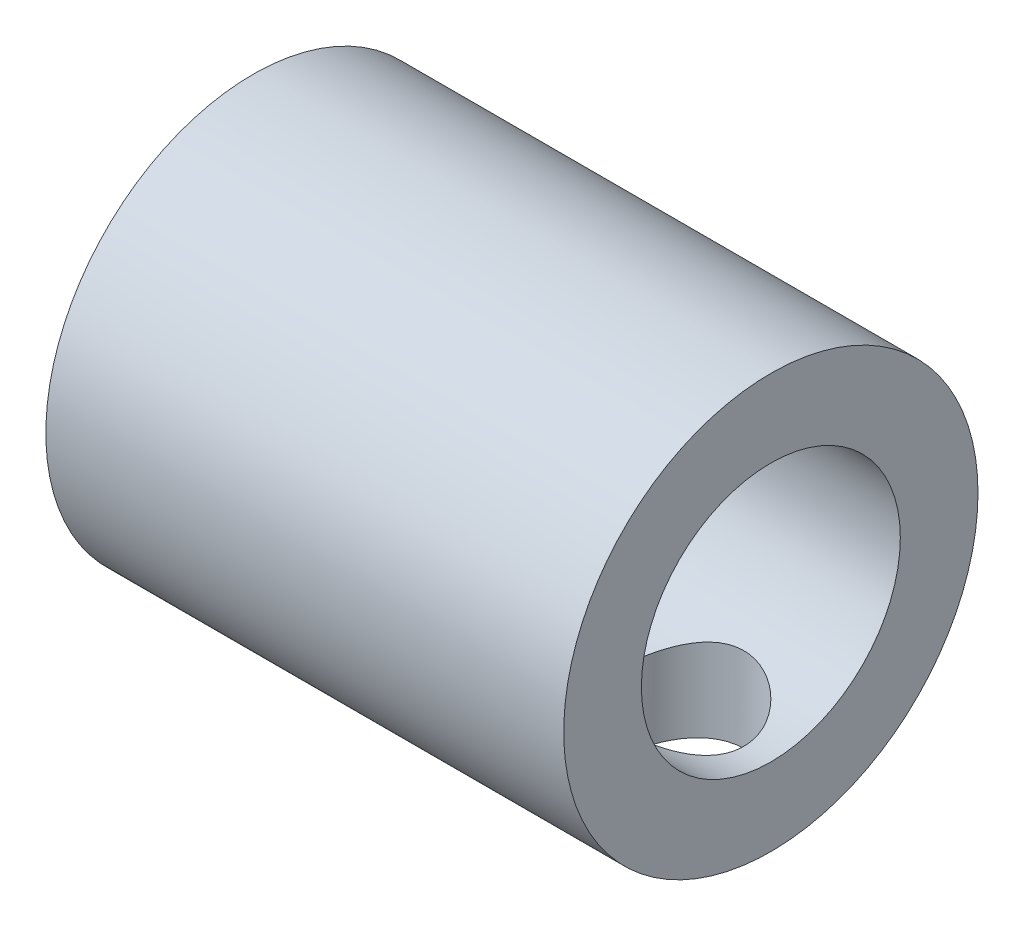
from build123d import *

# Parameters (mm, degrees)
SKETCH1_R               = 7.62
SKETCH1_R_2             = 4.7625
BOSS_EXTRUDE1_DEPTH     = 19.05
CUT_EXTRUDE1_REACH      = 23.887
CUT_EXTRUDE1_END_RADIUS = 7.62
SKETCH2_R               = 2.40157


with BuildPart() as part:
    # Sketch1 → Boss-Extrude1 (new body)
    with BuildSketch(Plane(origin=(0, 0, 0), x_dir=(0, 0, -1), z_dir=(1, 0, 0))):
        with Locations(Location((0, 0, 0), (0, 0, 180))):
            Circle(SKETCH1_R)
        with Locations(Location((0, 0, 0), (0, 0, 180))):
            Circle(SKETCH1_R_2, mode=Mode.SUBTRACT)
    extrude(amount=BOSS_EXTRUDE1_DEPTH)

    # Cut-Extrude1: up to this cylinder (the profile starts inside it)
    cut_extrude1_end = Plane(origin=(9.525, 0, 0), z_dir=(-1, 0, 0)) * Cylinder(CUT_EXTRUDE1_END_RADIUS, 76.273524, mode=Mode.PRIVATE)
    # Sketch2 → Cut-Extrude1 (cut, up to the surface)
    with BuildSketch(Plane(origin=(0, 0, 0), x_dir=(1, 0, 0), z_dir=(0, 1, 0)), mode=Mode.PRIVATE) as cut_extrude1_sk1:
        with Locations(Location((15.654762024, 0, 0), (0, 0, 270))):
            Circle(SKETCH2_R)
    cut_extrude1_tool1 = extrude(cut_extrude1_sk1.sketch, amount=-CUT_EXTRUDE1_REACH, mode=Mode.PRIVATE) & cut_extrude1_end
    add(cut_extrude1_tool1.solids().sort_by_distance((15.654762, 0, 0))[0], mode=Mode.SUBTRACT)
    # Sketch2 → Cut-Extrude1 (cut, up to the surface)
    with BuildSketch(Plane(origin=(0, 0, 0), x_dir=(1, 0, 0), z_dir=(0, 1, 0)), mode=Mode.PRIVATE) as cut_extrude1_sk2:
        with Locations(Location((3.395237976, 0, 0), (0, 0, 270))):
            Circle(SKETCH2_R)
    cut_extrude1_tool2 = extrude(cut_extrude1_sk2.sketch, amount=-CUT_EXTRUDE1_REACH, mode=Mode.PRIVATE) & cut_extrude1_end
    add(cut_extrude1_tool2.solids().sort_by_distance((3.395238, 0, 0))[0], mode=Mode.SUBTRACT)


solid = part.part
